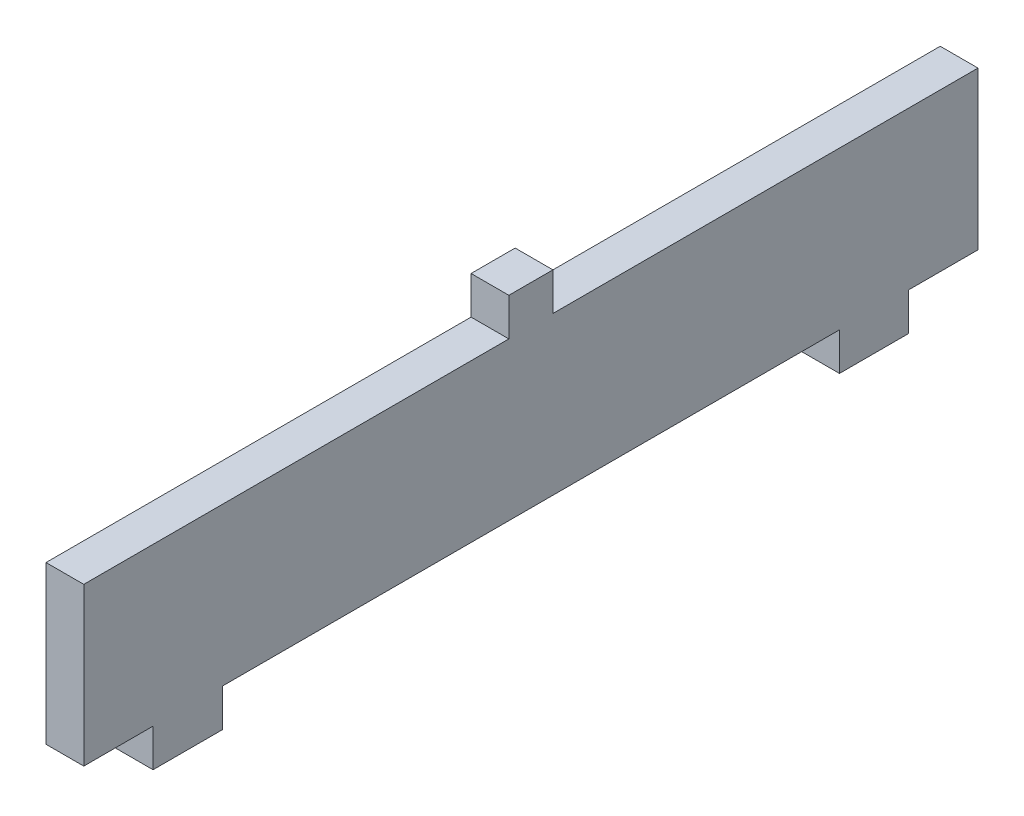
from build123d import *

# Parameters (mm, degrees)
SALIENTE_EXTRUIR1_DEPTH = 3


with BuildPart() as part:
    # Croquis1 → Saliente-Extruir1 (new body)
    with BuildSketch(Plane(origin=(0, 0, 0), x_dir=(0, 0, -1), z_dir=(1, 0, 0))):
        Polygon((1.75, 6.25), (35.5, 6.25), (35.5, -6.25), (30, -6.25), (30, -9.25), (24.5, -9.25), (24.5, -6.25), (-24.5, -6.25), (-24.5, -9.25), (-30, -9.25), (-30, -6.25), (-35.5, -6.25), (-35.5, 6.25), (-1.75, 6.25), (-1.75, 9.25), (1.75, 9.25), align=None)
    extrude(amount=SALIENTE_EXTRUIR1_DEPTH)


solid = part.part
